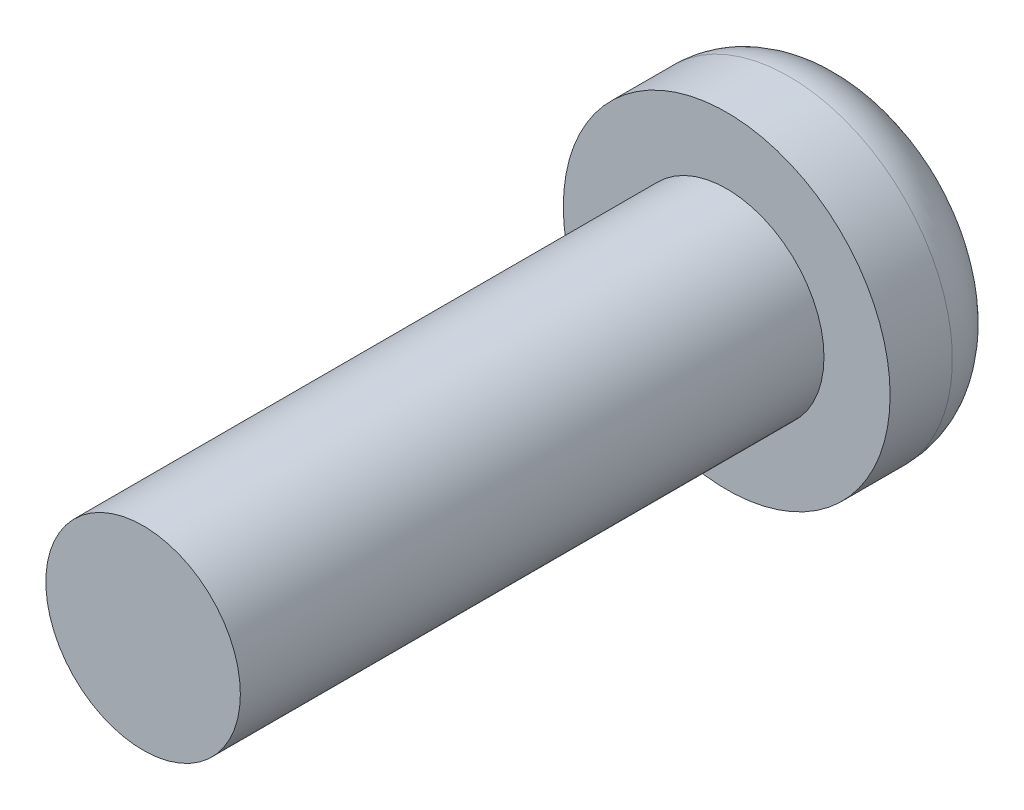
from build123d import *

# Parameters (mm, degrees)
SKETCH1_R           = 2.1
BOSS_EXTRUDE1_DEPTH = 1.6
SKETCH3_W           = 0.5
SKETCH3_H           = 0.75
SKETCH3_W_2         = 0.75
SKETCH3_H_2         = 0.5
CUT_EXTRUDE1_DEPTH  = 0.5
SKETCH4_R           = 1.25
BOSS_EXTRUDE2_DEPTH = 7.5


with BuildPart() as part:
    # Sketch1 → Boss-Extrude1 (new body)
    with BuildSketch(Plane.XY):
        Circle(SKETCH1_R)
    extrude(amount=BOSS_EXTRUDE1_DEPTH)

    # Sketch2 → Cut-Revolve1 (revolve, cut)
    with BuildSketch(Plane(origin=(0, 0, 0), x_dir=(1, 0, 0), z_dir=(0, 1, 0))):
        with BuildLine():
            Line((-2.1, -0.8), (-2.1, 0))
            Line((-2.1, 0), (-1.3, 0))
            ThreePointArc((-1.3, 0), (-1.865685425, -0.234314575), (-2.1, -0.8))
        make_face()
    revolve(axis=Axis((0, 0, 0), (0, 0, 1)), mode=Mode.SUBTRACT)

    # Sketch3 → Cut-Extrude1 (cut)
    with BuildSketch(Plane(origin=(0, 0, 0), x_dir=(-1, 0, 0), z_dir=(0, 0, -1))):
        with Locations((0, -0.625)):
            Rectangle(SKETCH3_W, SKETCH3_H)
        with Locations((0.625, 0)):
            Rectangle(SKETCH3_W_2, SKETCH3_H_2)
        with Locations((-0.625, 0)):
            Rectangle(SKETCH3_W_2, SKETCH3_H_2)
        with Locations((0, 0.625)):
            Rectangle(SKETCH3_W, SKETCH3_H)
        Rectangle(SKETCH3_W, SKETCH3_H_2)
    extrude(amount=-CUT_EXTRUDE1_DEPTH, mode=Mode.SUBTRACT)

    # Sketch4 → Boss-Extrude2 (add)
    with BuildSketch(Plane.XY.offset(1.6)):
        Circle(SKETCH4_R)
    extrude(amount=BOSS_EXTRUDE2_DEPTH)


solid = part.part
